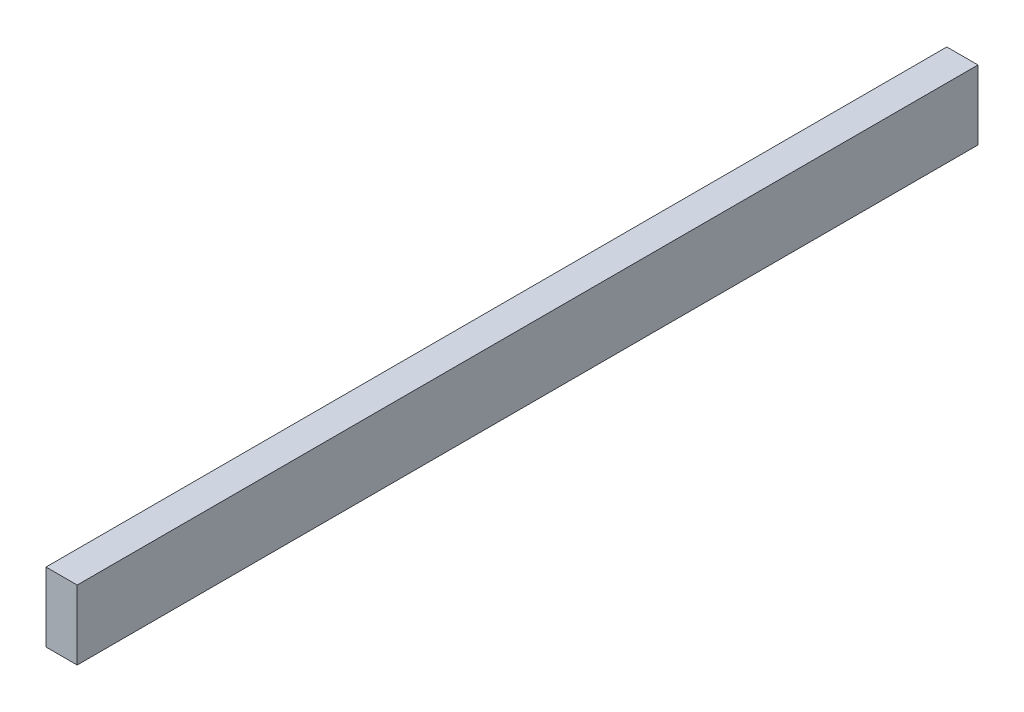
from build123d import *

# Parameters (mm, degrees)
ESQUISSE1_W        = 27
ESQUISSE1_H        = 60
BOSS_EXTRU_1_DEPTH = 780


with BuildPart() as part:
    # Esquisse1 → Boss.-Extru.1 (new body)
    with BuildSketch(Plane.XY):
        with Locations((13.5, 30)):
            Rectangle(ESQUISSE1_W, ESQUISSE1_H)
    extrude(amount=BOSS_EXTRU_1_DEPTH)


solid = part.part
